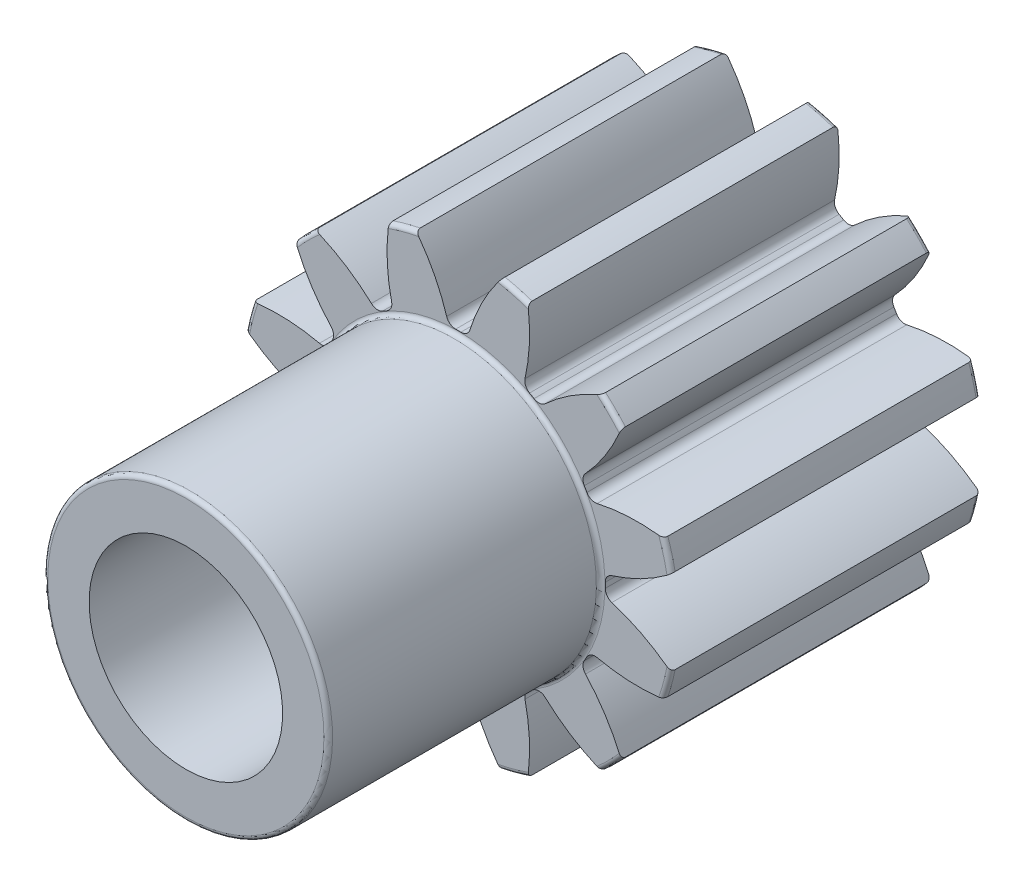
from build123d import *

# Parameters (mm, degrees)
FILLET2_R          = 0.17779999999999999
CUT_EXTRUDE2_DEPTH = 18.870484094674108
CIRPATTERN1_COUNT  = 12


with BuildPart() as part:
    # Sketch4 → Revolve1 (revolve)
    with BuildSketch(Plane(origin=(0, 0, 0), x_dir=(0, 0, -1), z_dir=(1, 0, 0))):
        Polygon((-23.875999999999998, 3.96875), (-23.875999999999998, 5.842), (-12.700000000000001, 5.842), (-12.700000000000001, 8.889999999999999), (0, 8.889999999999999), (0, 3.96875), align=None)
    revolve(axis=Axis((0, 2.33e-15, 12.7), (0, -3.3e-16, 1)))

    # Fillet2
    fillet2_edges = [part.edges().sort_by_distance(p)[0] for p in [
        (-1.09e-15, -8.889999999999985, -6.5e-15),
        (-1.09e-15, -8.889999999999995, 12.699999999999994),
        (1.88e-15, -5.841999999999994, 12.699999999999998),
        (1.88e-15, -5.842000000000003, 23.875999999999994),
    ]]
    fillet(fillet2_edges, radius=FILLET2_R)

    # Sketch7 → Cut-Extrude2 (cut, through all)
    with BuildSketch(Plane.XY.offset(12.7)):
        with BuildLine():
            ThreePointArc((-0.10685919844168043, 6.031553478309583), (3.7e-16, 6.032500000000002), (0.10685919844168043, 6.031553478309583))
            ThreePointArc((0.10685919844168043, 6.031553478309583), (0.3367850507372432, 6.103693889603269), (0.47744454060566766, 6.299359534021029))
            ThreePointArc((0.47744454060566766, 6.299359534021029), (1.0002429933975012, 7.565612145614136), (1.7413194000555385, 8.717792538652787))
            ThreePointArc((1.7413194000555385, 8.717792538652787), (5.4e-16, 8.889999999999999), (-1.7413194000555385, 8.717792538652787))
            ThreePointArc((-1.7413194000555385, 8.717792538652787), (-1.0002429933975003, 7.565612145614134), (-0.47744454060566766, 6.299359534021029))
            ThreePointArc((-0.47744454060566766, 6.299359534021029), (-0.33678505073724324, 6.103693889603269), (-0.10685919844168043, 6.031553478309583))
        make_face()
    cut_extrude2 = extrude(amount=-CUT_EXTRUDE2_DEPTH, mode=Mode.SUBTRACT)

    # CirPattern1: Cut-Extrude2 ×12 about axis
    cirpattern1_axis = Axis((2.45e-15, -9e-17, 0), (0, 0, 1))
    for i in range(1, CIRPATTERN1_COUNT):
        add(cut_extrude2.rotate(cirpattern1_axis, i * 360 / CIRPATTERN1_COUNT), mode=Mode.SUBTRACT)


solid = part.part
